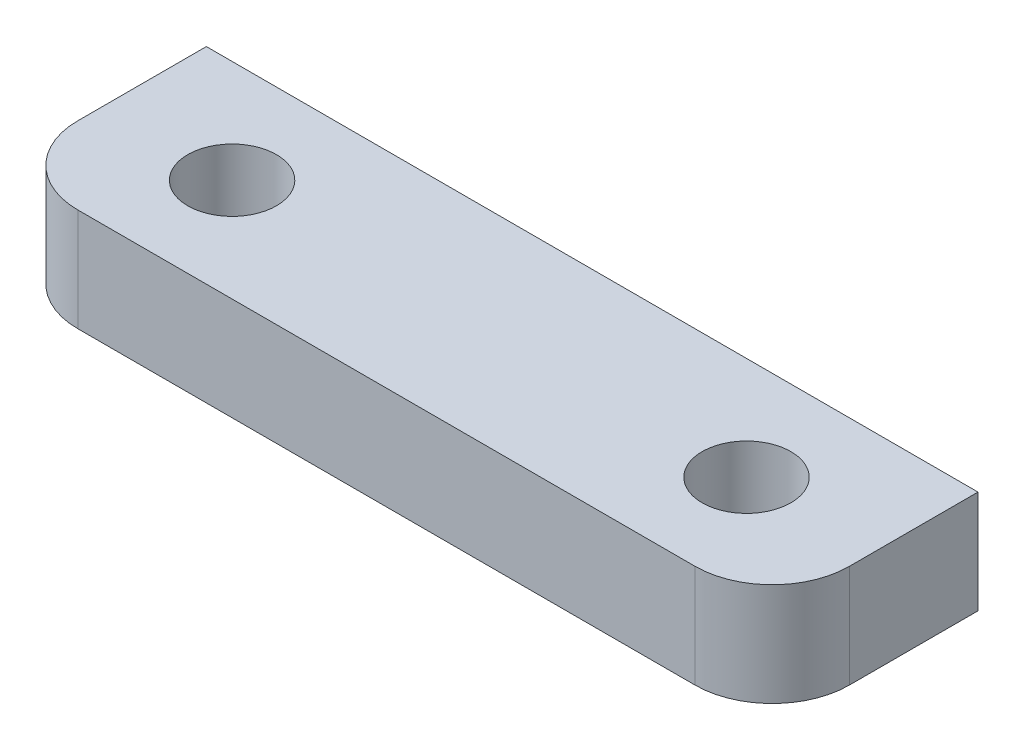
from build123d import *

# Parameters (mm, degrees)
SKETCH1_W           = 30
SKETCH1_H           = 8
SKETCH1_R           = 1.725
BOSS_EXTRUDE1_DEPTH = 4
FILLET1_R           = 3


with BuildPart() as part:
    # Sketch1 → Boss-Extrude1 (new body)
    with BuildSketch(Plane(origin=(0, 0, 0), x_dir=(1, 0, 0), z_dir=(0, 1, 0))):
        with Locations((10, 0)):
            Rectangle(SKETCH1_W, SKETCH1_H)
        with Locations(Location((0, 0, 0), (0, 0, 270))):
            Circle(SKETCH1_R, mode=Mode.SUBTRACT)
        with Locations(Location((20, 0, 0), (0, 0, 270))):
            Circle(SKETCH1_R, mode=Mode.SUBTRACT)
    extrude(amount=BOSS_EXTRUDE1_DEPTH)

    # Fillet1
    fillet1_edges = [part.edges().sort_by_distance(p)[0] for p in [
        (25, 2, 4),
        (-5, 2, 4),
    ]]
    fillet(fillet1_edges, radius=FILLET1_R)


solid = part.part
